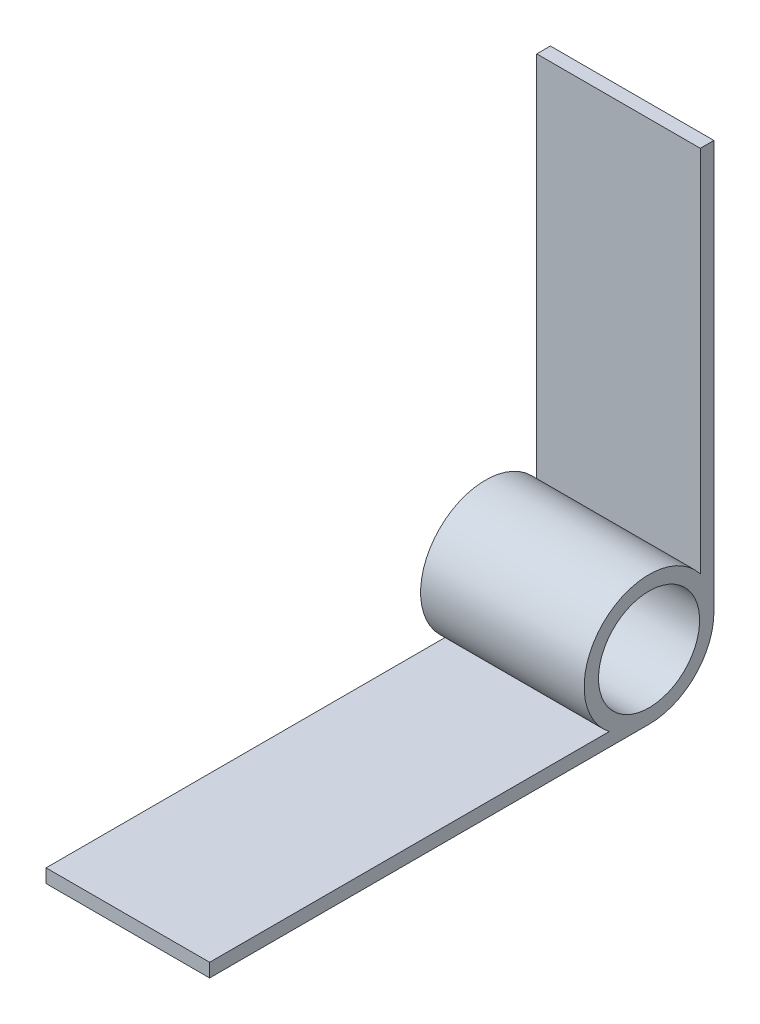
from build123d import *

# Parameters (mm, degrees)
SKETCH1_R           = 2.35585
BOSS_EXTRUDE1_DEPTH = 7.62


with BuildPart() as part:
    # Sketch1 → Boss-Extrude1 (new body)
    with BuildSketch(Plane(origin=(0, 0, 0), x_dir=(0, 0, -1), z_dir=(1, 0, 0))):
        with BuildLine():
            Line((3.0226, 0), (3.0226, 19.0246))
            Line((3.0226, 19.0246), (2.3876, 19.0246))
            Line((2.3876, 19.0246), (2.3876, 1.853503979))
            ThreePointArc((2.3876, 1.853503979), (-2.137300957, 2.137300957), (-1.853503979, -2.3876))
            Line((-1.853503979, -2.3876), (-20.4724, -2.3876))
            Line((-20.4724, -2.3876), (-20.4724, -3.0226))
            Line((-20.4724, -3.0226), (0, -3.0226))
            ThreePointArc((0, -3.0226), (2.137300957, -2.137300957), (3.0226, 0))
        make_face()
        with Locations(Location((0, 0, 0), (0, 0, 180))):
            Circle(SKETCH1_R, mode=Mode.SUBTRACT)
    extrude(amount=BOSS_EXTRUDE1_DEPTH)


solid = part.part
